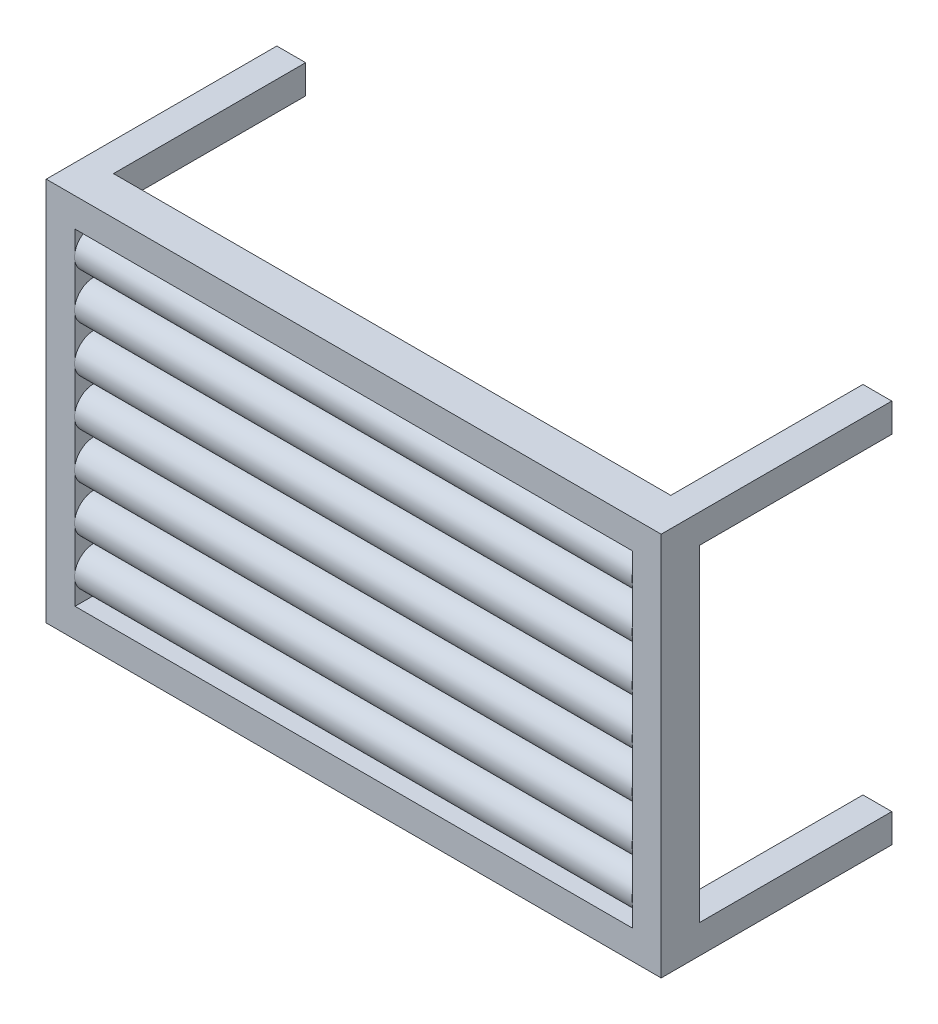
from build123d import *

# Parameters (mm, degrees)
SKETCH1_W           = 406.4
SKETCH1_H           = 254
SKETCH1_W_2         = 368.3
SKETCH1_H_2         = 215.9
BOSS_EXTRUDE1_DEPTH = 25.4
SKETCH2_R           = 12.7
BOSS_EXTRUDE2_DEPTH = 368.3
SKETCH3_W           = 19.05
SKETCH3_H           = 19.05
BOSS_EXTRUDE3_DEPTH = 127


with BuildPart() as part:
    # Sketch1 → Boss-Extrude1 (new body)
    with BuildSketch(Plane.XY):
        with Locations((203.2, 127)):
            Rectangle(SKETCH1_W, SKETCH1_H)
        with Locations((203.2, 127)):
            Rectangle(SKETCH1_W_2, SKETCH1_H_2, mode=Mode.SUBTRACT)
    extrude(amount=BOSS_EXTRUDE1_DEPTH)

    # Sketch2 → Boss-Extrude2 (add)
    with BuildSketch(Plane(origin=(19.05, 0, 0), x_dir=(0, 0, -1), z_dir=(1, 0, 0))):
        with Locations(Location((-13.001554518, 219.046700044, 0), (0, 0, 192.51070534))):
            Circle(SKETCH2_R)
        with Locations(Location((-13.001554518, 188.566700044, 0), (0, 0, 192.51070534))):
            Circle(SKETCH2_R)
        with Locations(Location((-13.001554518, 158.086700044, 0), (0, 0, 192.51070534))):
            Circle(SKETCH2_R)
        with Locations(Location((-13.001554518, 127.606700044, 0), (0, 0, 192.51070534))):
            Circle(SKETCH2_R)
        with Locations(Location((-13.001554518, 97.126700044, 0), (0, 0, 192.51070534))):
            Circle(SKETCH2_R)
        with Locations(Location((-13.001554518, 66.646700044, 0), (0, 0, 192.51070534))):
            Circle(SKETCH2_R)
        with Locations(Location((-13.001554518, 36.166700044, 0), (0, 0, 192.51070534))):
            Circle(SKETCH2_R)
    extrude(amount=BOSS_EXTRUDE2_DEPTH)

    # Sketch3 → Boss-Extrude3 (add)
    with BuildSketch(Plane(origin=(0, 0, 0), x_dir=(-1, 0, 0), z_dir=(0, 0, -1))):
        with Locations((-396.875, 244.475)):
            Rectangle(SKETCH3_W, SKETCH3_H)
        with Locations((-396.875, 9.525)):
            Rectangle(SKETCH3_W, SKETCH3_H)
        with Locations((-9.525, 244.475)):
            Rectangle(SKETCH3_W, SKETCH3_H)
        with Locations((-9.525, 9.525)):
            Rectangle(SKETCH3_W, SKETCH3_H)
    extrude(amount=BOSS_EXTRUDE3_DEPTH)


solid = part.part
